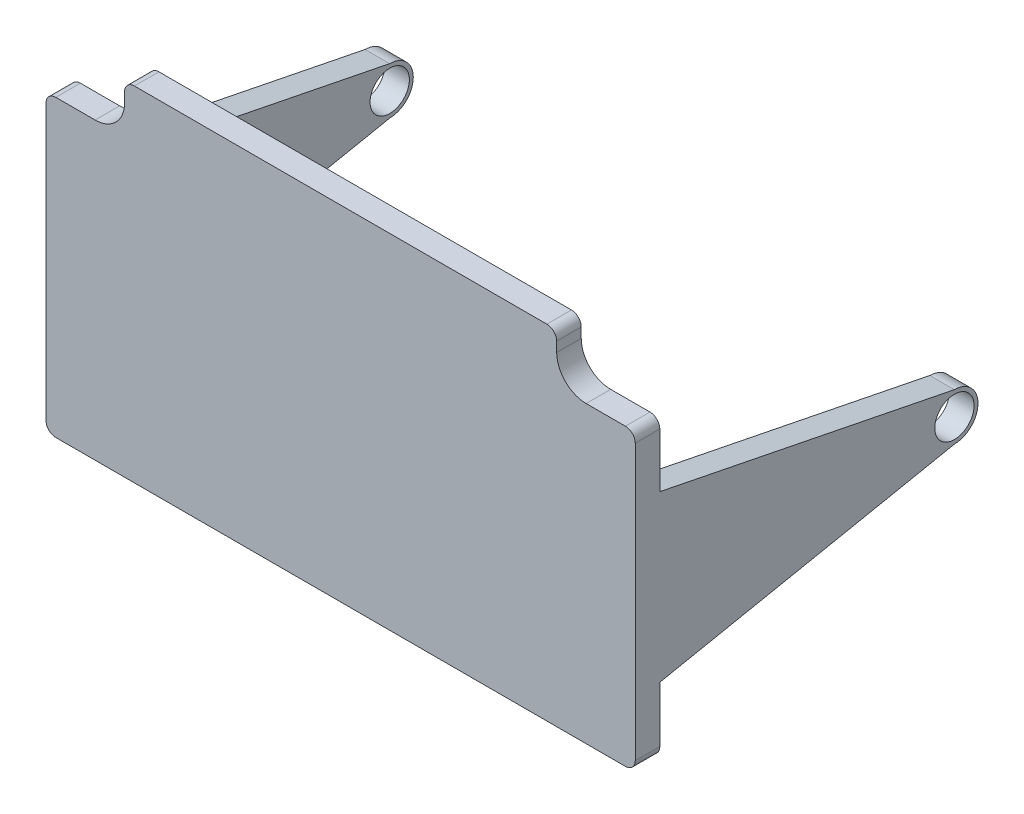
from build123d import *

# Parameters (mm, degrees)
SALIENTE_EXTRUIR1_DEPTH = 2.5
REDONDEO1_R             = 1
REDONDEO2_R             = 1
CROQUIS3_W              = 2.5
CROQUIS3_H              = 4.8076308
SALIENTE_EXTRUIR2_DEPTH = 30
SALIENTE_EXTRUIR3_DEPTH = 2.5
SALIENTE_EXTRUIR4_START = -2.5
SALIENTE_EXTRUIR4_DEPTH = 2.5
CROQUIS6_R              = 2
CORTAR_EXTRUIR1_DEPTH   = 100


with BuildPart() as part:
    # Croquis2 → Saliente-Extruir1 (new body)
    with BuildSketch(Plane.XY):
        with BuildLine():
            Line((30, -15), (-30, -15))
            Line((-30, -15), (-30, 15))
            Line((-30, 15), (-25, 15))
            ThreePointArc((-25, 15), (-22.878679656, 15.878679656), (-22, 18))
            Line((-22, 18), (-22, 20))
            Line((-22, 20), (22, 20))
            Line((22, 20), (22, 18))
            ThreePointArc((22, 18), (22.878679656, 15.878679656), (25, 15))
            Line((25, 15), (30, 15))
            Line((30, 15), (30, -15))
        make_face()
    extrude(amount=-SALIENTE_EXTRUIR1_DEPTH)

    # Redondeo1
    redondeo1_edges = [part.edges().sort_by_distance(p)[0] for p in [
        (-22, 20, -1.25),
        (22, 20, -1.25),
    ]]
    fillet(redondeo1_edges, radius=REDONDEO1_R)

    # Redondeo2
    redondeo2_edges = [part.edges().sort_by_distance(p)[0] for p in [
        (30, 15, -1.25),
        (30, -15, -1.25),
        (-30, -15, -1.25),
        (-30, 15, -1.25),
    ]]
    fillet(redondeo2_edges, radius=REDONDEO2_R)

    # Croquis3 → Saliente-Extruir2 (add)
    with BuildSketch(Plane(origin=(0, 0, -2.5), x_dir=(-1, 0, 0), z_dir=(0, 0, -1))):
        with Locations((28.75, 0.071092992)):
            Rectangle(CROQUIS3_W, CROQUIS3_H)
        with Locations((-28.75, 0.071092992)):
            Rectangle(CROQUIS3_W, CROQUIS3_H)
    extrude(amount=SALIENTE_EXTRUIR2_DEPTH)

    # Croquis4 → Saliente-Extruir3 (add)
    with BuildSketch(Plane(origin=(30, 0, 0), x_dir=(0, 0, -1), z_dir=(1, 0, 0))):
        with BuildLine():
            Line((32.5, -2.332722408), (2.5, -8.332722408))
            Line((2.5, -8.332722408), (2.5, 2.474908392))
            Line((2.5, 2.474908392), (2.5, 8.474908392))
            Line((2.5, 8.474908392), (32.5, 2.474908392))
            Line((32.5, 2.474908392), (32.5, 2.471092992))
            ThreePointArc((32.5, 2.471092992), (34.9, 0.071092992), (32.5, -2.328907008))
            Line((32.5, -2.328907008), (32.5, -2.332722408))
        make_face()
    extrude(amount=-SALIENTE_EXTRUIR3_DEPTH)

    # Croquis5 → Saliente-Extruir4 (add)
    with BuildSketch(Plane.ZY.offset(30).offset(SALIENTE_EXTRUIR4_START)):
        with BuildLine():
            Line((-2.5, 8.474908392), (-2.5, -8.332722408))
            Line((-2.5, -8.332722408), (-32.5, -2.332722408))
            Line((-32.5, -2.332722408), (-32.5, -2.328907008))
            ThreePointArc((-32.5, -2.328907008), (-34.9, 0.071092992), (-32.5, 2.471092992))
            Line((-32.5, 2.471092992), (-32.5, 2.474908392))
            Line((-32.5, 2.474908392), (-2.5, 8.474908392))
        make_face()
    extrude(amount=SALIENTE_EXTRUIR4_DEPTH)

    # Croquis6 → Cortar-Extruir1 (cut)
    with BuildSketch(Plane(origin=(30, 0, 0), x_dir=(0, 0, -1), z_dir=(1, 0, 0))):
        with Locations((32.5, 0.071092992)):
            Circle(CROQUIS6_R)
    extrude(amount=-CORTAR_EXTRUIR1_DEPTH, mode=Mode.SUBTRACT)


solid = part.part
